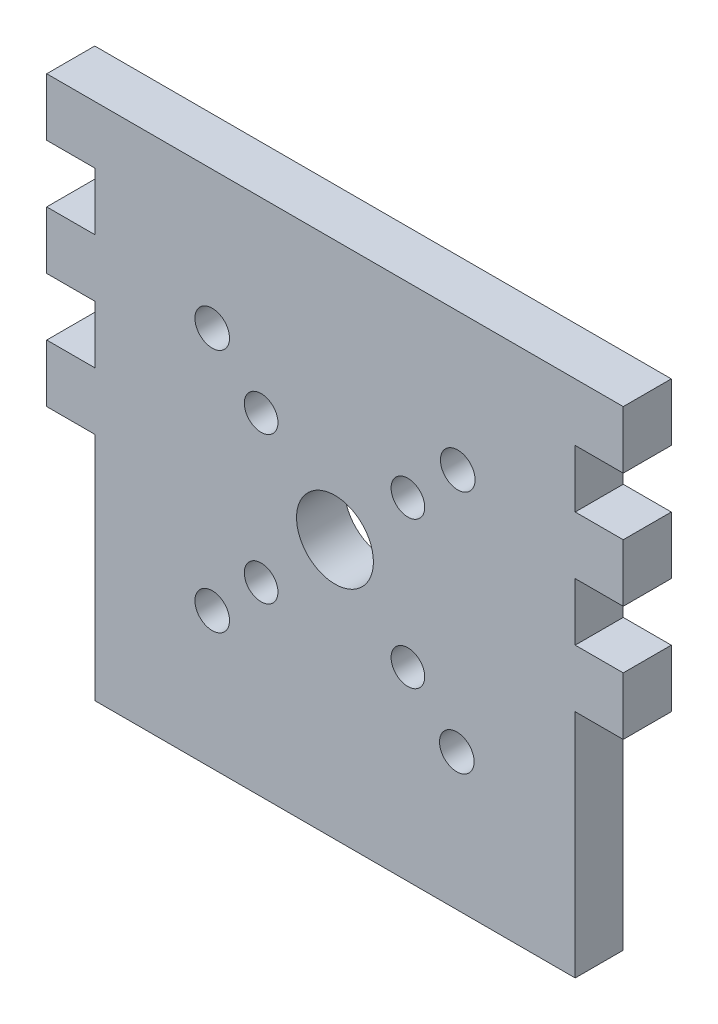
from build123d import *

# Parameters (mm, degrees)
SKETCH1_W           = 76.2
SKETCH1_H           = 76.2
BOSS_EXTRUDE1_DEPTH = 6.35
CUT_EXTRUDE1_DEPTH  = 6.35
SKETCH3_W           = 6.35
SKETCH3_H           = 38.1
CUT_EXTRUDE2_DEPTH  = 6.35
SKETCH4_W           = 6.35
SKETCH4_H           = 7.62
BOSS_EXTRUDE3_DEPTH = 6.35
SKETCH5_W           = 63.5
SKETCH5_H           = 6.35
CUT_EXTRUDE3_DEPTH  = 7.62
SKETCH6_R           = 5.08
SKETCH6_R_2         = 2.2225
SKETCH6_R_3         = 2.286
CUT_EXTRUDE4_DEPTH  = 71.769022866


with BuildPart() as part:
    # Sketch1 → Boss-Extrude1 (new body)
    with BuildSketch(Plane.XY):
        with Locations((0.21991342, -21.056709957)):
            Rectangle(SKETCH1_W, SKETCH1_H)
    extrude(amount=BOSS_EXTRUDE1_DEPTH)

    # Sketch2 → Cut-Extrude1 (cut)
    with BuildSketch(Plane.XY.offset(6.35)):
        Polygon((-37.88008658, 17.043290043), (-31.53008658, 17.043290043), (-31.53008658, 9.423290043), (-37.88008658, 9.423290043), (-37.88008658, 1.803290043), (-31.53008658, 1.803290043), (-31.53008658, -5.816709957), (-37.88008658, -5.816709957), (-37.88008658, -13.436709957), (-31.53008658, -13.436709957), (-31.53008658, -21.056709957), (-37.88008658, -21.056709957), (-46.725849744, -21.056709957), (-46.725849744, 17.043290043), align=None)
        Polygon((47.165676584, -21.056709957), (47.165676584, 17.043290043), (38.31991342, 17.043290043), (31.96991342, 17.043290043), (31.96991342, 9.423290043), (38.31991342, 9.423290043), (38.31991342, 1.803290043), (31.96991342, 1.803290043), (31.96991342, -5.816709957), (38.31991342, -5.816709957), (38.31991342, -13.436709957), (31.96991342, -13.436709957), (31.96991342, -21.056709957), (38.31991342, -21.056709957), align=None)
    extrude(amount=-CUT_EXTRUDE1_DEPTH, mode=Mode.SUBTRACT)

    # Sketch3 → Cut-Extrude2 (cut)
    with BuildSketch(Plane.XY.offset(6.35)):
        with Locations((-34.70508658, -40.106709957)):
            Rectangle(SKETCH3_W, SKETCH3_H)
        with Locations((35.14491342, -40.106709957)):
            Rectangle(SKETCH3_W, SKETCH3_H)
    extrude(amount=-CUT_EXTRUDE2_DEPTH, mode=Mode.SUBTRACT)

    # Sketch4 → Boss-Extrude3 (add)
    with BuildSketch(Plane.XY.offset(6.35)):
        with Locations((-34.70508658, -24.866709957)):
            Rectangle(SKETCH4_W, SKETCH4_H)
        with Locations((35.14491342, -24.866709957)):
            Rectangle(SKETCH4_W, SKETCH4_H)
    extrude(amount=-BOSS_EXTRUDE3_DEPTH)

    # Sketch5 → Cut-Extrude3 (cut)
    with BuildSketch(Plane(origin=(0, 17.043290043, 0), x_dir=(1, 0, 0), z_dir=(0, 1, 0))):
        with Locations((0.21991342, -3.175)):
            Rectangle(SKETCH5_W, SKETCH5_H)
    extrude(amount=-CUT_EXTRUDE3_DEPTH, mode=Mode.SUBTRACT)

    # Sketch6 → Cut-Extrude4 (cut, through all)
    with BuildSketch(Plane.XY.offset(6.35)):
        with Locations((0.21991342, -24.866709957)):
            Circle(SKETCH6_R)
        with Locations((-9.541624984, -34.62824836)):
            Circle(SKETCH6_R_2)
        with Locations((-16.005719951, -8.763829057)):
            Circle(SKETCH6_R_3)
        with Locations((-9.541419951, -15.231097531)):
            Circle(SKETCH6_R_2)
        with Locations((9.855730879, -15.231302564)):
            Circle(SKETCH6_R_2)
        with Locations((9.855525846, -34.628453393)):
            Circle(SKETCH6_R_2)
        with Locations(Location((16.445546791, -8.763829057, 0), (0, 0, 180))):
            Circle(SKETCH6_R_3)
        with Locations((16.323202085, -41.092751093)):
            Circle(SKETCH6_R_3)
        with Locations((-16.005719951, -41.092751093)):
            Circle(SKETCH6_R_3)
    extrude(amount=-CUT_EXTRUDE4_DEPTH, mode=Mode.SUBTRACT)


solid = part.part
